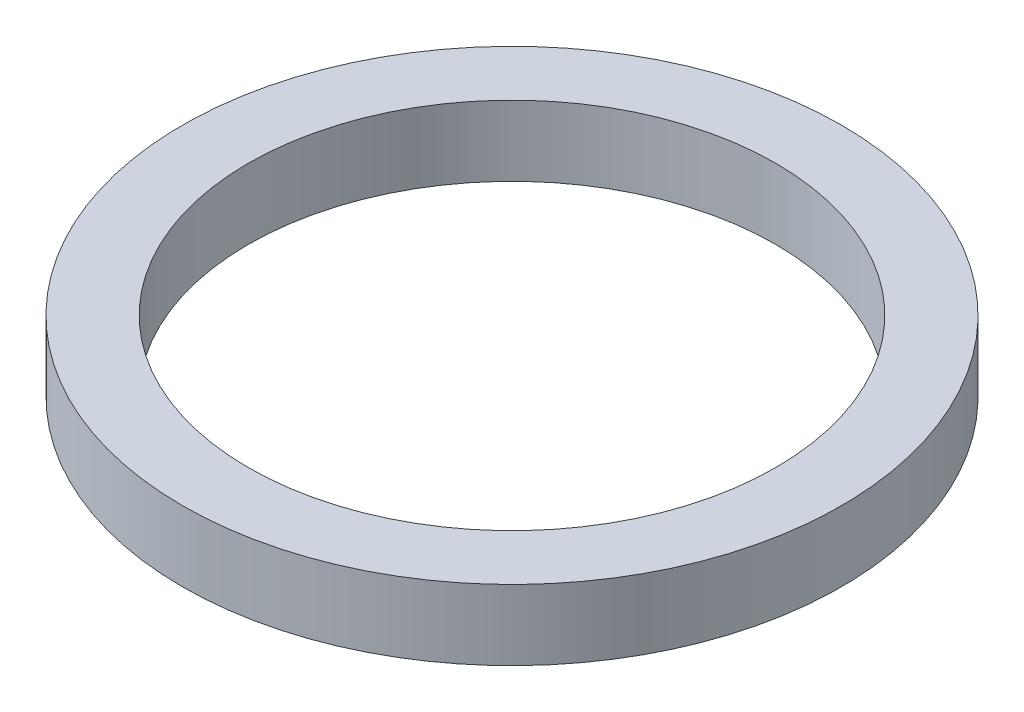
from build123d import *

# Parameters (mm, degrees)
SKETCH1_R           = 75
BOSS_EXTRUDE1_DEPTH = 16
SKETCH2_R           = 60
CUT_EXTRUDE1_DEPTH  = 16


with BuildPart() as part:
    # Sketch1 → Boss-Extrude1 (new body)
    with BuildSketch(Plane(origin=(0, 0, 0), x_dir=(1, 0, 0), z_dir=(0, 1, 0))):
        with Locations(Location((0, 0, 0), (0, 0, 270))):
            Circle(SKETCH1_R)
    extrude(amount=BOSS_EXTRUDE1_DEPTH)

    # Sketch2 → Cut-Extrude1 (cut)
    with BuildSketch(Plane.XZ):
        with Locations(Location((0, 0, 0), (0, 0, 270))):
            Circle(SKETCH2_R)
    extrude(amount=-CUT_EXTRUDE1_DEPTH, mode=Mode.SUBTRACT)


solid = part.part
